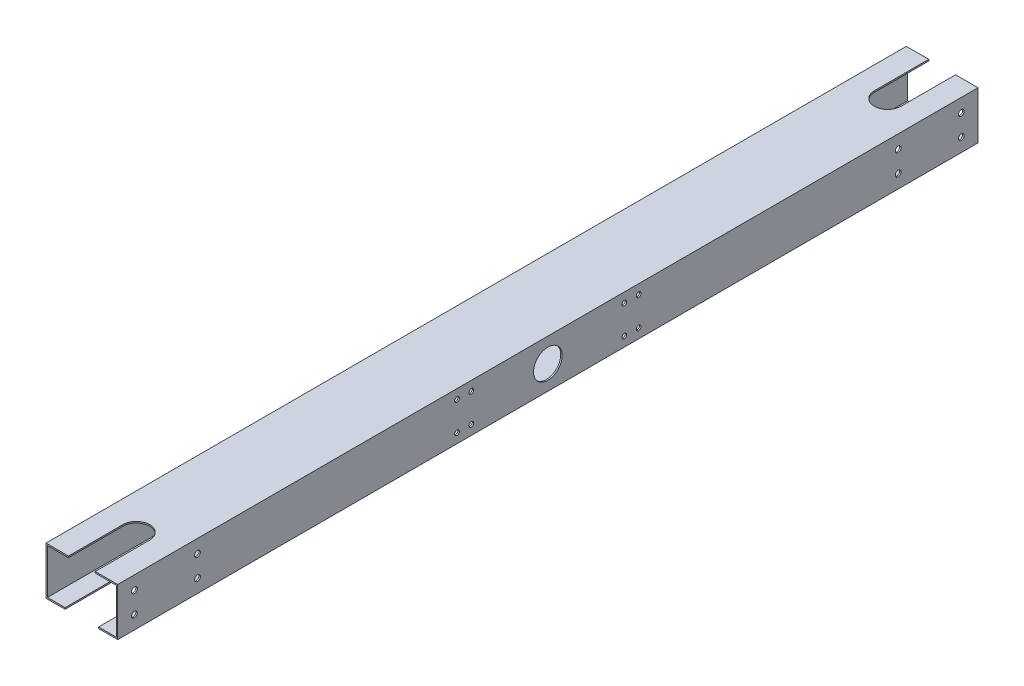
from build123d import *

# Parameters (mm, degrees)
SKETCH1_W           = 75
SKETCH1_H           = 50
SKETCH1_W_2         = 72
SKETCH1_H_2         = 47
BOSS_EXTRUDE1_DEPTH = 900
SKETCH2_R           = 15
CUT_EXTRUDE1_DEPTH  = 59
CUT_EXTRUDE2_DEPTH  = 10
CUT_EXTRUDE3_DEPTH  = 10
SKETCH5_R           = 3
CUT_EXTRUDE4_DEPTH  = 55
SKETCH7_R           = 2.5
CUT_EXTRUDE6_DEPTH  = 904.46554998
SKETCH8_R           = 15
CUT_EXTRUDE7_DEPTH  = 97


with BuildPart() as part:
    # Sketch1 → Boss-Extrude1 (new body)
    with BuildSketch(Plane.XY):
        Rectangle(SKETCH1_W, SKETCH1_H)
        Rectangle(SKETCH1_W_2, SKETCH1_H_2, mode=Mode.SUBTRACT)
    extrude(amount=BOSS_EXTRUDE1_DEPTH)

    # Sketch2 → Cut-Extrude1 (cut)
    with BuildSketch(Plane(origin=(37.5, 0, 0), x_dir=(0, 0, -1), z_dir=(1, 0, 0))):
        with Locations(Location((-450, 0, 0), (0, 0, 90))):
            Circle(SKETCH2_R)
    extrude(amount=-CUT_EXTRUDE1_DEPTH, mode=Mode.SUBTRACT)

    # Sketch3 → Cut-Extrude2 (cut)
    with BuildSketch(Plane(origin=(0, 25, 0), x_dir=(1, 0, 0), z_dir=(0, 1, 0))):
        with BuildLine():
            Line((14, -843), (14, -913.98611775))
            ThreePointArc((14, -913.98611775), (0, -927.98611775), (-14, -913.98611775))
            Line((-14, -913.98611775), (-14, -843))
            ThreePointArc((-14, -843), (0, -829), (14, -843))
        make_face()
    cut_extrude2 = extrude(amount=-CUT_EXTRUDE2_DEPTH, mode=Mode.SUBTRACT)

    # Sketch4 → Cut-Extrude3 (cut)
    with BuildSketch(Plane.XZ.offset(25)):
        with BuildLine():
            Line((-17.498938419, 850), (-17.498938419, 939.078503923))
            ThreePointArc((-17.498938419, 939.078503923), (0.001061581, 956.578503923), (17.501061581, 939.078503923))
            Line((17.501061581, 939.078503923), (17.501061581, 850))
            ThreePointArc((17.501061581, 850), (0.001061581, 832.5), (-17.498938419, 850))
        make_face()
    cut_extrude3 = extrude(amount=-CUT_EXTRUDE3_DEPTH, mode=Mode.SUBTRACT)

    # Sketch5 → Cut-Extrude4 (cut)
    with BuildSketch(Plane(origin=(37.5, 0, 0), x_dir=(0, 0, -1), z_dir=(1, 0, 0))):
        with Locations(Location((-882.5, 11, 0), (0, 0, 90))):
            Circle(SKETCH5_R)
        with Locations(Location((-882.5, -11, 0), (0, 0, 90))):
            Circle(SKETCH5_R)
        with Locations(Location((-816.5, -11, 0), (0, 0, 270))):
            Circle(SKETCH5_R)
        with Locations(Location((-816.5, 11, 0), (0, 0, 270))):
            Circle(SKETCH5_R)
    cut_extrude4 = extrude(amount=-CUT_EXTRUDE4_DEPTH, mode=Mode.SUBTRACT)

    # Mirror1: Cut-Extrude2, Cut-Extrude3, Cut-Extrude4 across plane
    add(cut_extrude2.mirror(Plane.XY.offset(450)), mode=Mode.SUBTRACT)
    add(cut_extrude3.mirror(Plane.XY.offset(450)), mode=Mode.SUBTRACT)
    add(cut_extrude4.mirror(Plane.XY.offset(450)), mode=Mode.SUBTRACT)

    # Sketch7 → Cut-Extrude6 (cut, through all)
    with BuildSketch(Plane.ZY.offset(37.5)):
        with Locations(Location((355, 15, 0), (0, 0, 270))):
            Circle(SKETCH7_R)
        with Locations(Location((370, 15, 0), (0, 0, 90))):
            Circle(SKETCH7_R)
        with Locations(Location((370, -15, 0), (0, 0, 270))):
            Circle(SKETCH7_R)
        with Locations(Location((355, -15, 0), (0, 0, 90))):
            Circle(SKETCH7_R)
        with Locations(Location((545, -15, 0), (0, 0, 270))):
            Circle(SKETCH7_R)
        with Locations(Location((530, -15, 0), (0, 0, 90))):
            Circle(SKETCH7_R)
        with Locations(Location((530, 15, 0), (0, 0, 270))):
            Circle(SKETCH7_R)
        with Locations(Location((545, 15, 0), (0, 0, 90))):
            Circle(SKETCH7_R)
    extrude(amount=-CUT_EXTRUDE6_DEPTH, mode=Mode.SUBTRACT)

    # Sketch8 → Cut-Extrude7 (cut)
    with BuildSketch(Plane(origin=(37.5, 0, 0), x_dir=(0, 0, -1), z_dir=(1, 0, 0))):
        with Locations(Location((-450, 0, 0), (0, 0, 90))):
            Circle(SKETCH8_R)
    extrude(amount=-CUT_EXTRUDE7_DEPTH, mode=Mode.SUBTRACT)


solid = part.part
